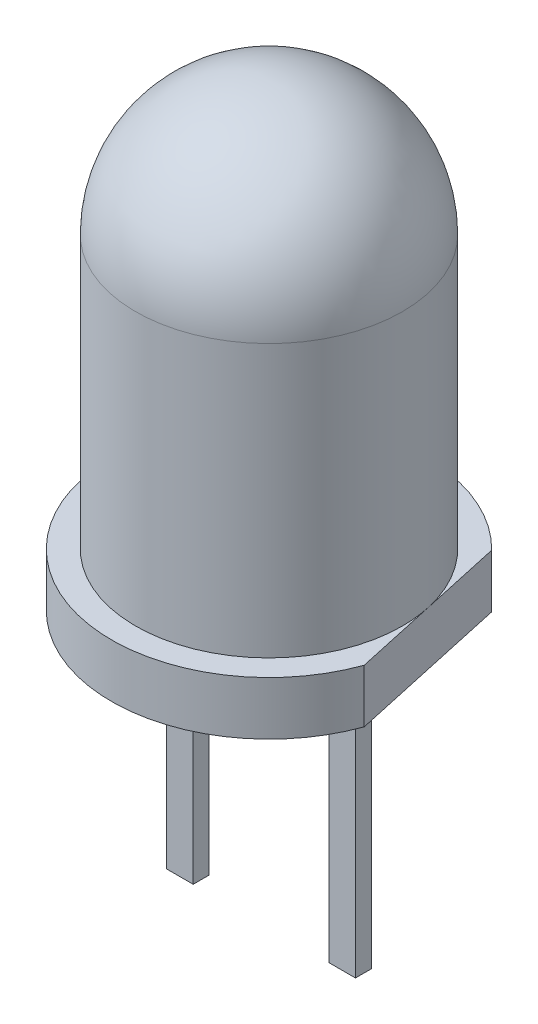
from build123d import *

# Parameters (mm, degrees)
BOSS_EXTRUDE1_DEPTH = 1
SKETCH4_W           = 0.5
SKETCH4_H           = 5
BOSS_EXTRUDE2_DEPTH = 0.15


with BuildPart() as part:
    # Sketch1 → Revolve1 (revolve)
    with BuildSketch(Plane.XY):
        with BuildLine():
            Line((2.5, 4.02324589), (2.5, -1.07675411))
            Line((2.5, -1.07675411), (0, -1.07675411))
            Line((0, -1.07675411), (0, 6.52324589))
            ThreePointArc((0, 6.52324589), (1.767766953, 5.791012843), (2.5, 4.02324589))
        make_face()
    revolve(axis=Axis((0, -170.01390881, 0), (0, 1, 0)))

    # Sketch2 → Boss-Extrude1 (add)
    with BuildSketch(Plane.XZ.offset(1.07675411)):
        with BuildLine():
            Line((2.10585574, -2.065882766), (2.777744802, 0.993294426))
            ThreePointArc((2.777744802, 0.993294426), (-2.88132432, 0.632827121), (2.10585574, -2.065882766))
        make_face()
    extrude(amount=BOSS_EXTRUDE1_DEPTH)

    # Sketch4 → Boss-Extrude2 (add, symmetric)
    with BuildSketch(Plane.XY):
        with Locations((1.52, -4.57675411)):
            Rectangle(SKETCH4_W, SKETCH4_H)
        with Locations((-1.52, -4.57675411)):
            Rectangle(SKETCH4_W, SKETCH4_H)
    extrude(amount=BOSS_EXTRUDE2_DEPTH, both=True)


solid = part.part
